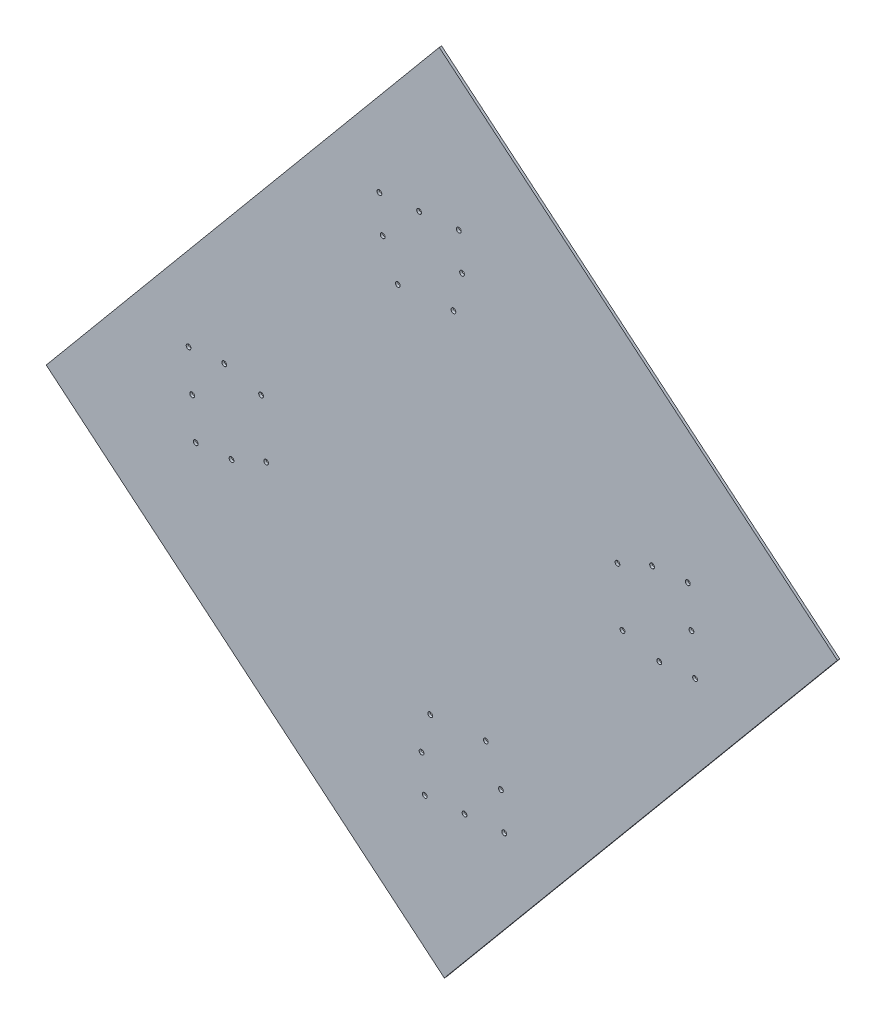
from build123d import *

# Parameters (mm, degrees)
SKETCH1_R           = 3
BOSS_EXTRUDE1_DEPTH = 3


with BuildPart() as part:
    # Sketch1 → Boss-Extrude1 (new body)
    with BuildSketch(Plane.XY):
        Polygon((1018.05312216, -2273.263793346), (1511.008064266, -1681.744203601), (1011.673345649, -1265.613408316), (518.718403543, -1857.132998062), align=None)
        with Locations((701.753786497, -1797.896182314)):
            Circle(SKETCH1_R, mode=Mode.SUBTRACT)
        with Locations((1327.972681313, -1740.981019348)):
            Circle(SKETCH1_R, mode=Mode.SUBTRACT)
        with Locations((1235.174126546, -1714.270941976)):
            Circle(SKETCH1_R, mode=Mode.SUBTRACT)
        with Locations((1278.631701009, -1695.259387021)):
            Circle(SKETCH1_R, mode=Mode.SUBTRACT)
        with Locations((1323.446984512, -1691.186259901)):
            Circle(SKETCH1_R, mode=Mode.SUBTRACT)
        with Locations((697.228089696, -1748.101422866)):
            Circle(SKETCH1_R, mode=Mode.SUBTRACT)
        with Locations((788.216365742, -1754.893596459)):
            Circle(SKETCH1_R, mode=Mode.SUBTRACT)
        with Locations((742.043373199, -1744.028295746)):
            Circle(SKETCH1_R, mode=Mode.SUBTRACT)
        with Locations((751.0947668, -1843.617814641)):
            Circle(SKETCH1_R, mode=Mode.SUBTRACT)
        with Locations((794.552341263, -1824.606259686)):
            Circle(SKETCH1_R, mode=Mode.SUBTRACT)
        with Locations((706.279483297, -1847.690941762)):
            Circle(SKETCH1_R, mode=Mode.SUBTRACT)
        with Locations((1241.510102067, -1783.983605203)):
            Circle(SKETCH1_R, mode=Mode.SUBTRACT)
        with Locations((1332.498378113, -1790.775778796)):
            Circle(SKETCH1_R, mode=Mode.SUBTRACT)
        with Locations((1287.68309461, -1794.848905917)):
            Circle(SKETCH1_R, mode=Mode.SUBTRACT)
        with Locations((940.684020094, -1505.670133727)):
            Circle(SKETCH1_R, mode=Mode.SUBTRACT)
        with Locations((936.610892974, -1460.854850224)):
            Circle(SKETCH1_R, mode=Mode.SUBTRACT)
        with Locations((986.405652422, -1456.329153423)):
            Circle(SKETCH1_R, mode=Mode.SUBTRACT)
        with Locations((1036.200411869, -1451.803456623)):
            Circle(SKETCH1_R, mode=Mode.SUBTRACT)
        with Locations((1040.27353899, -1496.618740126)):
            Circle(SKETCH1_R, mode=Mode.SUBTRACT)
        with Locations((1029.408238276, -1542.791732669)):
            Circle(SKETCH1_R, mode=Mode.SUBTRACT)
        with Locations((959.695575049, -1549.12770819)):
            Circle(SKETCH1_R, mode=Mode.SUBTRACT)
        with Locations((1089.042447715, -2033.207067936)):
            Circle(SKETCH1_R, mode=Mode.SUBTRACT)
        with Locations((1093.115574835, -2078.022351439)):
            Circle(SKETCH1_R, mode=Mode.SUBTRACT)
        with Locations((1043.320815387, -2082.548048239)):
            Circle(SKETCH1_R, mode=Mode.SUBTRACT)
        with Locations((993.52605594, -2087.07374504)):
            Circle(SKETCH1_R, mode=Mode.SUBTRACT)
        with Locations((989.452928819, -2042.258461537)):
            Circle(SKETCH1_R, mode=Mode.SUBTRACT)
        with Locations((1000.318229533, -1996.085468994)):
            Circle(SKETCH1_R, mode=Mode.SUBTRACT)
        with Locations((1070.03089276, -1989.749493473)):
            Circle(SKETCH1_R, mode=Mode.SUBTRACT)
    extrude(amount=BOSS_EXTRUDE1_DEPTH)


solid = part.part
